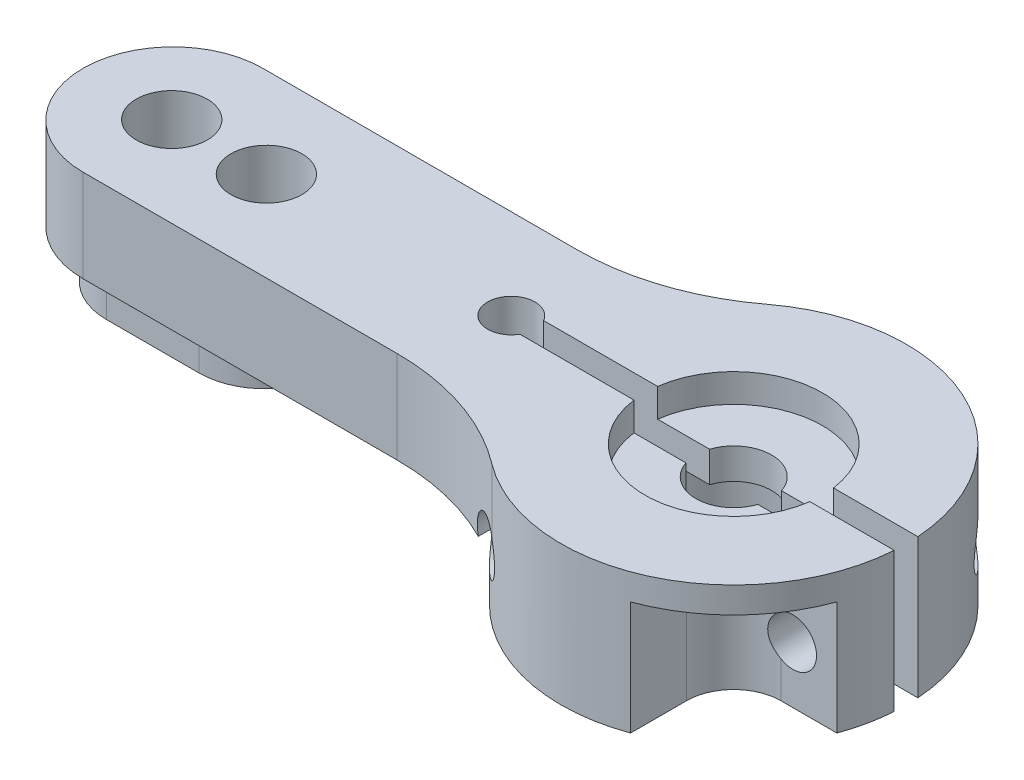
from build123d import *

# Parameters (mm, degrees)
BOSS_EXTRU_1_DEPTH            = 3.9
BOSS_EXTRU_2_START            = 2
ESQUISSE2_R                   = 7.3
BOSS_EXTRU_2_DEPTH            = 2
D_GAGEMENT_M31_D              = 3.2
DIAM_TRE_DU_PER_AGE_3_0_3_1_D = 3
ESQUISSE6_R                   = 2.75
ENL_V_MAT_EXTRU_1_DEPTH       = 3.4
ESQUISSE9_R                   = 3.75
ENL_V_MAT_EXTRU_2_DEPTH       = 1.2
ENL_V_MAT_EXTRU_3_DEPTH       = 30.057701217
ENL_V_MAT_EXTRU_4_DEPTH       = 4.8
ENL_V_MAT_EXTRU_5_DEPTH       = 29.718460962
ENL_V_MAT_EXTRU_5_DEPTH_BACK  = 29.718460962
ESQUISSE14_R                  = 1


with BuildPart() as part:
    # Esquisse1 → Boss.-Extru.1 (new body)
    with BuildSketch(Plane(origin=(0, 0, 0), x_dir=(1, 0, 0), z_dir=(0, 1, 0))):
        with BuildLine():
            Line((-10.433120339, 3.8), (-23.7, 3.8))
            ThreePointArc((-23.7, 3.8), (-27.5, 0), (-23.7, -3.8))
            Line((-23.7, -3.8), (-10.433120339, -3.8))
            ThreePointArc((-10.433120339, -3.8), (-7.252616143, -4.319261998), (-4.402414941, -5.823121387))
            ThreePointArc((-4.402414941, -5.823121387), (7.3, 0), (-4.402414941, 5.823121387))
            ThreePointArc((-4.402414941, 5.823121387), (-7.252616143, 4.319261998), (-10.433120339, 3.8))
        make_face()
    extrude(amount=BOSS_EXTRU_1_DEPTH)

    # Esquisse2 → Boss.-Extru.2 (add)
    with BuildSketch(Plane(origin=(0, 0, 0), x_dir=(-1, 0, 0), z_dir=(0, -1, 0)).offset(BOSS_EXTRU_2_START)):
        Circle(ESQUISSE2_R)
        with BuildLine():
            Line((23.7, -2.8), (19.8, -2.8))
            ThreePointArc((19.8, -2.8), (17, 0), (19.8, 2.8))
            Line((19.8, 2.8), (23.7, 2.8))
            ThreePointArc((23.7, 2.8), (26.5, 0), (23.7, -2.8))
        make_face()
    extrude(amount=-BOSS_EXTRU_2_DEPTH)

    # Dégagement M31 (through all)
    with Locations(Plane(origin=(0, 3.9, 0), x_dir=(1, 0, 0), z_dir=(0, 1, 0))):
        with Locations((0, 0)):
            Hole(D_GAGEMENT_M31_D / 2)

    # Diamètre du perçage Ø3.0 (3)1 (through all)
    with Locations(Plane(origin=(0, -2, 0), x_dir=(-1, 0, 0), z_dir=(0, -1, 0))):
        with Locations((19.75, 0), (23.75, 0)):
            Hole(DIAM_TRE_DU_PER_AGE_3_0_3_1_D / 2)

    # Esquisse6 → Enlèv. mat.-Extru.1 (cut)
    with BuildSketch(Plane.XZ.offset(2)):
        Circle(ESQUISSE6_R)
    extrude(amount=-ENL_V_MAT_EXTRU_1_DEPTH, mode=Mode.SUBTRACT)

    # Esquisse9 → Enlèv. mat.-Extru.2 (cut)
    with BuildSketch(Plane(origin=(0, 3.9, 0), x_dir=(1, 0, 0), z_dir=(0, 1, 0))):
        Circle(ESQUISSE9_R)
    extrude(amount=-ENL_V_MAT_EXTRU_2_DEPTH, mode=Mode.SUBTRACT)

    # Esquisse10 → Enlèv. mat.-Extru.3 (cut, through all)
    with BuildSketch(Plane(origin=(0, 3.9, 0), x_dir=(1, 0, 0), z_dir=(0, 1, 0))):
        with BuildLine():
            Line((-8.533974596, 0.5), (7.987060463, 0.5))
            Line((7.987060463, 0.5), (7.987060463, -0.5))
            Line((7.987060463, -0.5), (-8.533974596, -0.5))
            ThreePointArc((-8.533974596, -0.5), (-10.4, 0), (-8.533974596, 0.5))
        make_face()
    extrude(amount=-ENL_V_MAT_EXTRU_3_DEPTH, mode=Mode.SUBTRACT)

    # Esquisse11 → Enlèv. mat.-Extru.4 (cut)
    with BuildSketch(Plane.XZ.offset(2)):
        with BuildLine():
            Line((2.5, 6.85857128), (2.5, 4.5))
            ThreePointArc((2.5, 4.5), (3.085786438, 3.085786438), (4.5, 2.5))
            Line((4.5, 2.5), (6.85857128, 2.5))
            ThreePointArc((6.85857128, 2.5), (5.161879503, 5.161879503), (2.5, 6.85857128))
        make_face()
        with BuildLine():
            Line((-2.5, -4.5), (-2.5, -6.85857128))
            Line((-2.5, -6.85857128), (-4.5, -6.85857128))
            Line((-4.5, -6.85857128), (-9.098379022, -3.889477026))
            ThreePointArc((-9.098379022, -3.889477026), (-8.17646592, -2.875581558), (-6.85857128, -2.5))
            Line((-6.85857128, -2.5), (-4.5, -2.5))
            ThreePointArc((-4.5, -2.5), (-3.085786438, -3.085786438), (-2.5, -4.5))
        make_face()
    extrude(amount=-ENL_V_MAT_EXTRU_4_DEPTH, mode=Mode.SUBTRACT)

    # Esquisse14 → Enlèv. mat.-Extru.5 (cut, two sides: drawn at the far end of the back side and taken through both)
    with BuildSketch(Plane.XY.offset(-ENL_V_MAT_EXTRU_5_DEPTH_BACK)):
        with Locations((5, 0.4)):
            Circle(ESQUISSE14_R)
        with Locations((-5, 0.4)):
            Circle(ESQUISSE14_R)
    extrude(amount=ENL_V_MAT_EXTRU_5_DEPTH + ENL_V_MAT_EXTRU_5_DEPTH_BACK, mode=Mode.SUBTRACT)


solid = part.part
